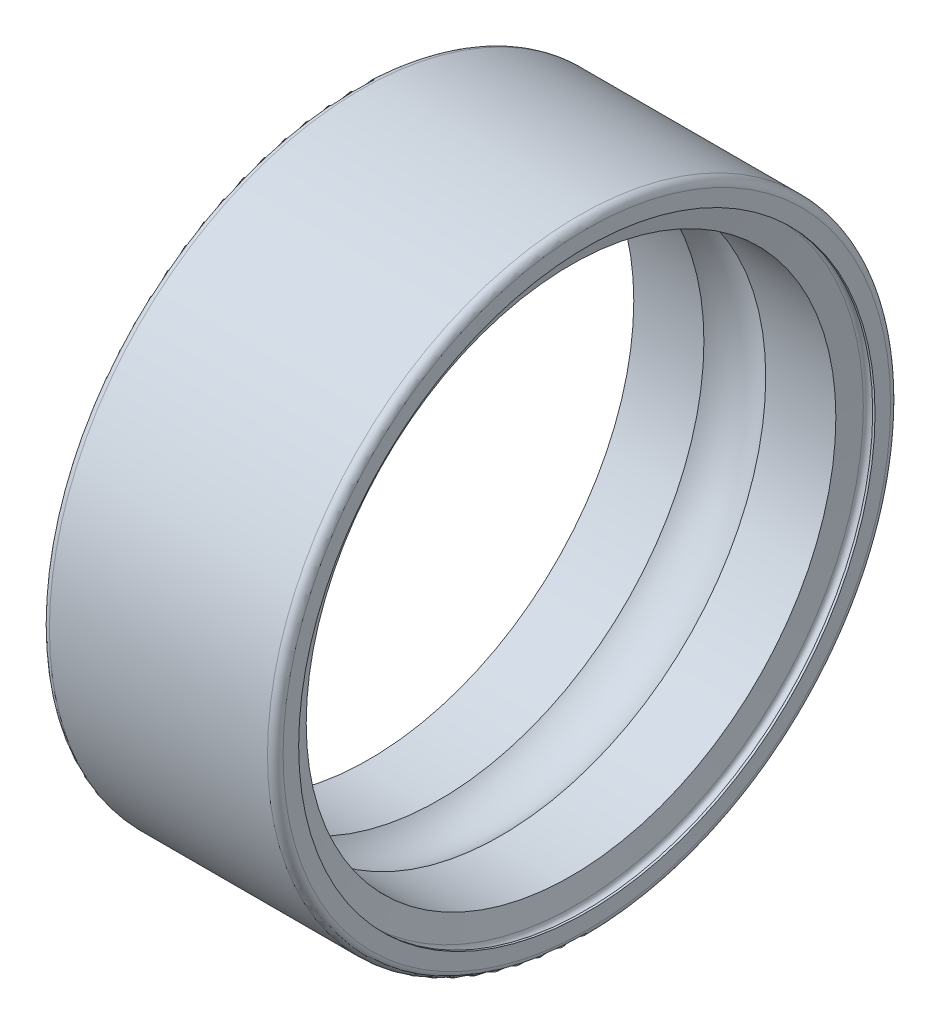
from build123d import *


with BuildPart() as part:
    # Sketch1 → Revolve1 (revolve)
    with BuildSketch(Plane.XY, mode=Mode.PRIVATE) as revolve1_sk:
        with BuildLine():
            Line((0, 3.9), (0, 3.7))
            Line((0, 3.7), (0.03, 3.7))
            ThreePointArc((0.03, 3.7), (0.09, 3.76), (0.15, 3.7))
            Line((0.15, 3.7), (0.202898094, 3.4))
            Line((0.202898094, 3.4), (1.103137303, 3.4))
            ThreePointArc((1.103137303, 3.4), (1.5, 3.55), (1.896862697, 3.4))
            Line((1.896862697, 3.4), (2.797101906, 3.4))
            Line((2.797101906, 3.4), (2.85, 3.7))
            ThreePointArc((2.85, 3.7), (2.91, 3.76), (2.97, 3.7))
            Line((2.97, 3.7), (3, 3.7))
            Line((3, 3.7), (3, 3.9))
            ThreePointArc((3, 3.9), (2.970710678, 3.970710678), (2.9, 4))
            Line((2.9, 4), (0.1, 4))
            ThreePointArc((0.1, 4), (0.029289322, 3.970710678), (0, 3.9))
        make_face()
    revolve(revolve1_sk.sketch.rotate(Axis((50, 0, 0), (-1, 0, 0)), 270), axis=Axis((50, 0, 0), (-1, 0, 0)))


solid = part.part
